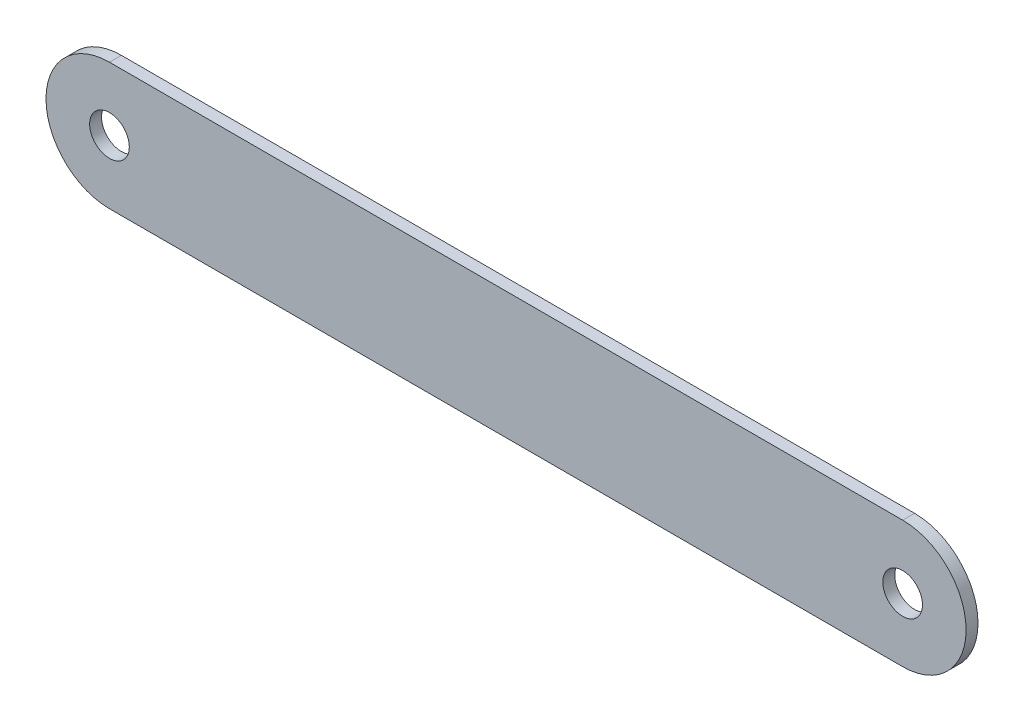
from build123d import *

# Parameters (mm, degrees)
EXTRUDE_1_DEPTH     = 3
SKETCH_2_R          = 5
CUT_EXTRUDE_1_DEPTH = 3


with BuildPart() as part:
    # 草图1 → 凸台-拉伸1 (new body)
    with BuildSketch(Plane.XY):
        with BuildLine():
            Line((0, -16), (-200, -16))
            ThreePointArc((-200, -16), (-216, 0), (-200, 16))
            Line((-200, 16), (0, 16))
            ThreePointArc((0, 16), (16, 0), (0, -16))
        make_face()
    extrude(amount=EXTRUDE_1_DEPTH)

    # 草图2 → 切除-拉伸1 (cut)
    with BuildSketch(Plane.XY.offset(3)):
        with Locations((-200, 0)):
            Circle(SKETCH_2_R)
        Circle(SKETCH_2_R)
    extrude(amount=-CUT_EXTRUDE_1_DEPTH, mode=Mode.SUBTRACT)


solid = part.part
